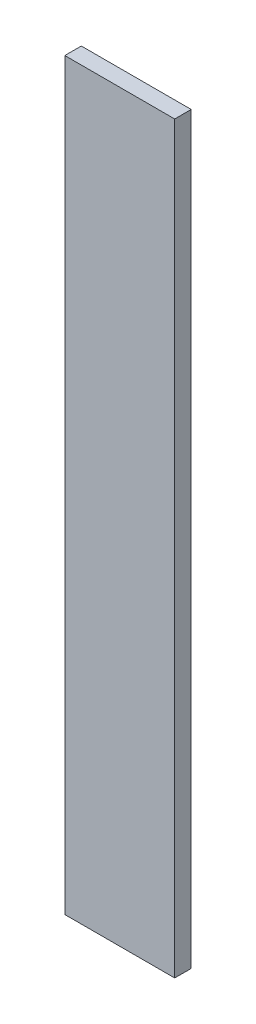
from build123d import *

# Parameters (mm, degrees)
SKETCH_1_W      = 1000
SKETCH_1_H      = 6770
EXTRUDE_1_DEPTH = 150


with BuildPart() as part:
    # Эскиз1 → Бобышка-Вытянуть1 (new body)
    with BuildSketch(Plane.XY):
        with Locations((500, -3385)):
            Rectangle(SKETCH_1_W, SKETCH_1_H)
    extrude(amount=EXTRUDE_1_DEPTH)


solid = part.part
